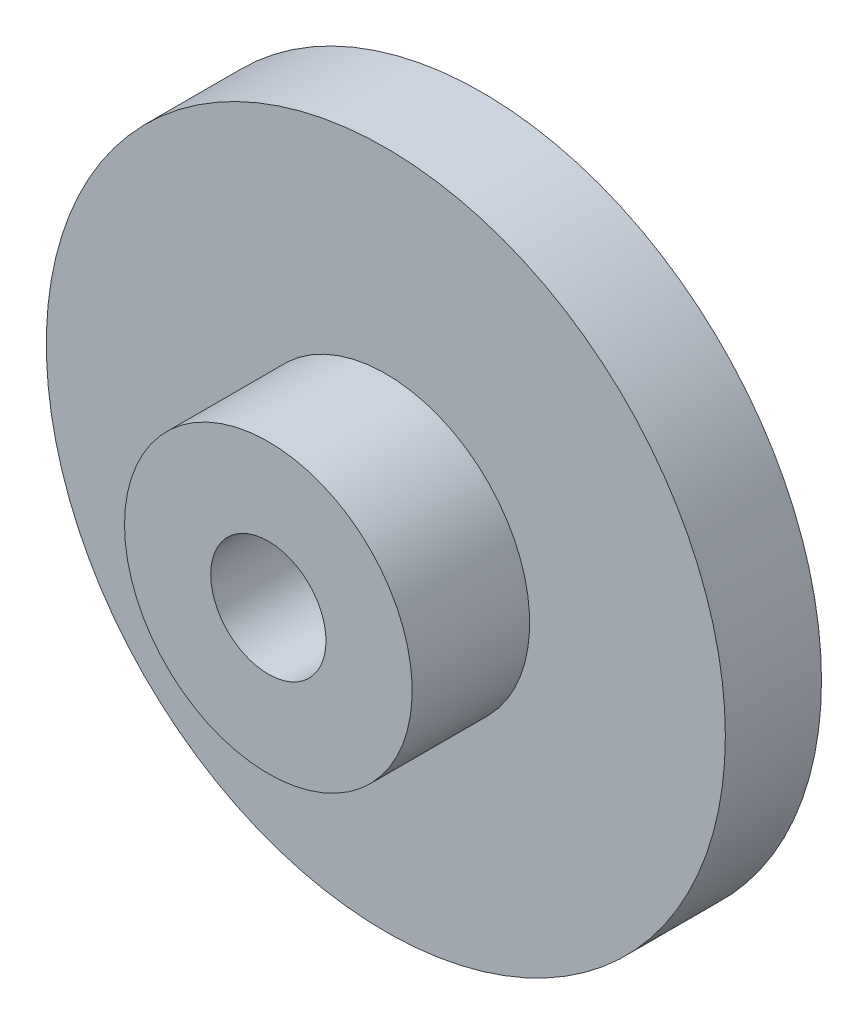
from build123d import *

# Parameters (mm, degrees)
SKETCH1_R           = 22.25
SKETCH1_R_2         = 3.775
BOSS_EXTRUDE1_DEPTH = 6.3
SKETCH2_R           = 9.425
SKETCH2_R_2         = 3.775
BOSS_EXTRUDE2_DEPTH = 7.7


with BuildPart() as part:
    # Sketch1 → Boss-Extrude1 (new body)
    with BuildSketch(Plane.XY):
        Circle(SKETCH1_R)
        Circle(SKETCH1_R_2, mode=Mode.SUBTRACT)
    extrude(amount=BOSS_EXTRUDE1_DEPTH)


with BuildPart() as body_2:
    # Sketch2 → Boss-Extrude2 (new body)
    with BuildSketch(Plane.XY.offset(6.3)):
        Circle(SKETCH2_R)
        Circle(SKETCH2_R_2, mode=Mode.SUBTRACT)
    extrude(amount=BOSS_EXTRUDE2_DEPTH)


solid = Compound([part.part, body_2.part])
